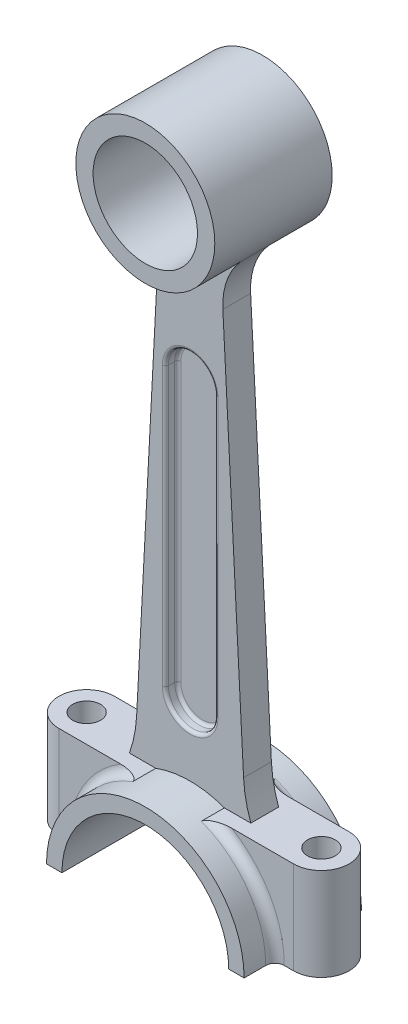
from build123d import *

# Parameters (mm, degrees)
SKETCH1_R               = 22.5
SKETCH1_R_2             = 16.9
BOSS_EXTRUDE3_DEPTH     = 19
BOSS_EXTRUDE3_2_DEPTH   = 19
BOSS_EXTRUDE5_DEPTH     = 4.5
CUT_EXTRUDE1_DEPTH      = 4
FILLET1_R               = 1
FILLET2_R               = 40
FILLET3_R               = 40
FILLET4_R               = 22.5
BOSS_EXTRUDE7_REACH     = 199.241
CUT_EXTRUDE3_DEPTH      = 206.637836892
CUT_EXTRUDE3_DEPTH_BACK = 206.637836892
CUT_EXTRUDE4_DEPTH      = 201.224099449
CUT_EXTRUDE4_DEPTH_BACK = 30
SKETCH7_R               = 4.5
FILLET5_R               = 3
FILLET6_R               = 3


with BuildPart() as part:
    # Sketch1 → Boss-Extrude3 (new, symmetric)
    with BuildSketch(Plane.XY):
        with Locations((0, 2.973059445)):
            Circle(SKETCH1_R)
        with Locations((0, 2.973059445)):
            Circle(SKETCH1_R_2, mode=Mode.SUBTRACT)
    extrude(amount=BOSS_EXTRUDE3_DEPTH, both=True)



with BuildPart() as body_2:
    # Sketch1 → Boss-Extrude3 2 (new, symmetric)
    with BuildSketch(Plane.XY):
        with BuildLine():
            Line((-31.990083534, -198.226940555), (-27, -198.226940555))
            ThreePointArc((-27, -198.226940555), (0, -171.226940555), (27, -198.226940555))
            Line((27, -198.226940555), (31.990083534, -198.226940555))
            ThreePointArc((31.990083534, -198.226940555), (0, -166.236857021), (-31.990083534, -198.226940555))
        make_face()
    extrude(amount=BOSS_EXTRUDE3_2_DEPTH, both=True)


with BuildPart() as part_1:
    add(part.part)

    add(body_2.part)  # Boss-Extrude5 merges body 2
    # Sketch1<8> → Boss-Extrude5 (add, symmetric)
    with BuildSketch(Plane.XY):
        with BuildLine():
            ThreePointArc((10, -17.182584926), (5.135562367, -18.933012753), (0, -19.526940555))
            Line((0, -19.526940555), (0, -166.236857021))
            ThreePointArc((0, -166.236857021), (9.478624111, -167.673362541), (18.105978431, -171.853867364))
            Line((18.105978431, -171.853867364), (10, -17.182584926))
        make_face()
        with BuildLine():
            Line((0, -166.236857021), (0, -19.526940555))
            ThreePointArc((0, -19.526940555), (-5.135562367, -18.933012753), (-10, -17.182584926))
            Line((-10, -17.182584926), (-18.105978431, -171.853867364))
            ThreePointArc((-18.105978431, -171.853867364), (-9.478624111, -167.673362541), (0, -166.236857021))
        make_face()
    extrude(amount=BOSS_EXTRUDE5_DEPTH, both=True)

    # Sketch3 → Cut-Extrude1 (cut)
    with BuildSketch(Plane.XY.offset(4.5)):
        with BuildLine():
            Line((8, -54.113470277), (8, -144.113470277))
            ThreePointArc((8, -144.113470277), (0, -152.113470277), (-8, -144.113470277))
            Line((-8, -144.113470277), (-8, -54.113470277))
            ThreePointArc((-8, -54.113470277), (0, -46.113470277), (8, -54.113470277))
        make_face()
    cut_extrude1 = extrude(amount=-CUT_EXTRUDE1_DEPTH, mode=Mode.SUBTRACT)

    # Mirror1: Cut-Extrude1 across plane
    add(cut_extrude1.mirror(Plane.XY), mode=Mode.SUBTRACT)

    # Fillet1
    fillet1_edges = [part_1.edges().sort_by_distance(p)[0] for p in [
        (0, -46.113470277, 0.5),
        (8, -99.113470277, 0.5),
        (0, -152.113470277, 0.5),
        (-8, -99.113470277, 0.5),
        (0, -46.113470277, 4.5),
        (-8, -99.113470277, 4.5),
        (0, -152.113470277, 4.5),
        (8, -99.113470277, 4.5),
        (0, -46.113470277, -4.5),
        (-8, -99.113470277, -4.5),
        (0, -152.113470277, -4.5),
        (8, -99.113470277, -4.5),
        (0, -46.113470277, -0.5),
        (-8, -99.113470277, -0.5),
        (0, -152.113470277, -0.5),
        (8, -99.113470277, -0.5),
    ]]
    fillet(fillet1_edges, radius=FILLET1_R)

    # Fillet2
    fillet2_edges = [part_1.edges().sort_by_distance(p)[0] for p in [
        (18.105978431, -171.853867364, 0),
    ]]
    fillet(fillet2_edges, radius=FILLET2_R)

    # Fillet3
    fillet3_edges = [part_1.edges().sort_by_distance(p)[0] for p in [
        (-18.105978431, -171.853867364, 0),
    ]]
    fillet(fillet3_edges, radius=FILLET3_R)

    # Fillet4
    fillet4_edges = [part_1.edges().sort_by_distance(p)[0] for p in [
        (10, -17.182584926, 0),
        (-10, -17.182584926, 0),
    ]]
    fillet(fillet4_edges, radius=FILLET4_R)

    # Boss-Extrude7: up to this face of the body (flat: up to its plane)
    boss_extrude7_end = Plane(part_1.part.faces().sort_by_distance((29.495041767, -198.226940555, 0))[0])
    # Sketch4 → Boss-Extrude7 (add, up to the picked face)
    with BuildSketch(Plane(origin=(0, -168.226940555, 0), x_dir=(-1, 0, 0), z_dir=(0, -1, 0)), mode=Mode.PRIVATE) as boss_extrude7_sk1:
        with BuildLine():
            Line((38, -9), (-38, -9))
            ThreePointArc((-38, -9), (-47, 0), (-38, 9))
            Line((-38, 9), (38, 9))
            ThreePointArc((38, 9), (47, 0), (38, -9))
        make_face()
    boss_extrude7_tool1 = split(extrude(boss_extrude7_sk1.sketch, amount=BOSS_EXTRUDE7_REACH, mode=Mode.PRIVATE), bisect_by=boss_extrude7_end, keep=Keep.BOTH, mode=Mode.PRIVATE)
    add(boss_extrude7_tool1.solids().sort_by(Axis((0, -168.226941, 0), (0, -1, 0)))[0])

    # Sketch6 → Cut-Extrude3 (cut, two sides: drawn at the far end of the back side and taken through both)
    with BuildSketch(Plane.XY.offset(9).offset(-CUT_EXTRUDE3_DEPTH_BACK)):
        with BuildLine():
            Line((-27, -198.226940555), (27, -198.226940555))
            ThreePointArc((27, -198.226940555), (0, -171.226940555), (-27, -198.226940555))
        make_face()
    extrude(amount=CUT_EXTRUDE3_DEPTH + CUT_EXTRUDE3_DEPTH_BACK, mode=Mode.SUBTRACT)

    # Sketch7 → Cut-Extrude4 (cut, two sides: drawn at the far end of the back side and taken through both)
    with BuildSketch(Plane(origin=(0, -168.226940555, 0), x_dir=(1, 0, 0), z_dir=(0, 1, 0)).offset(-CUT_EXTRUDE4_DEPTH_BACK)):
        with Locations(Location((-38, 0, 0), (0, 0, 270))):
            Circle(SKETCH7_R)
        with Locations(Location((38, 0, 0), (0, 0, 270))):
            Circle(SKETCH7_R)
    extrude(amount=CUT_EXTRUDE4_DEPTH + CUT_EXTRUDE4_DEPTH_BACK, mode=Mode.SUBTRACT)

    # Fillet5
    fillet5_edges = [part_1.edges().sort_by_distance(p)[0] for p in [
        (-26.255278477, -179.950567923, 9),
        (26.255278477, -179.950567923, 9),
    ]]
    fillet(fillet5_edges, radius=FILLET5_R)

    # Fillet6
    fillet6_edges = [part_1.edges().sort_by_distance(p)[0] for p in [
        (26.255278477, -179.950567923, -9),
        (-26.255278477, -179.950567923, -9),
    ]]
    fillet(fillet6_edges, radius=FILLET6_R)


solid = part_1.part
